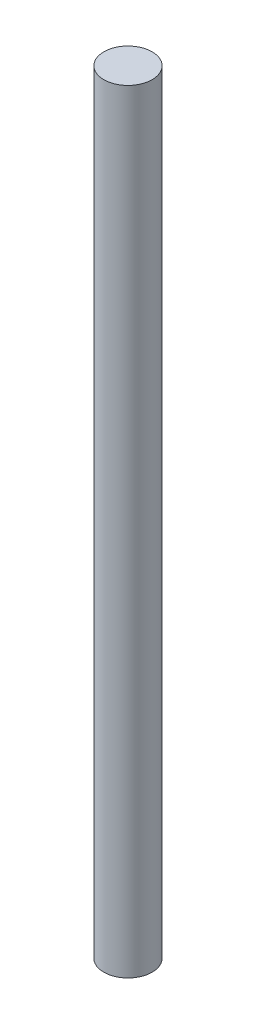
from build123d import *

# Parameters (mm, degrees)
SKETCH1_R           = 12.5
BOSS_EXTRUDE1_DEPTH = 200


with BuildPart() as part:
    # Sketch1 → Boss-Extrude1 (new, symmetric)
    with BuildSketch(Plane(origin=(0, 0, 0), x_dir=(1, 0, 0), z_dir=(0, 1, 0))):
        with Locations(Location((0, 0, 0), (0, 0, 270))):
            Circle(SKETCH1_R)
    extrude(amount=BOSS_EXTRUDE1_DEPTH, both=True)


solid = part.part
